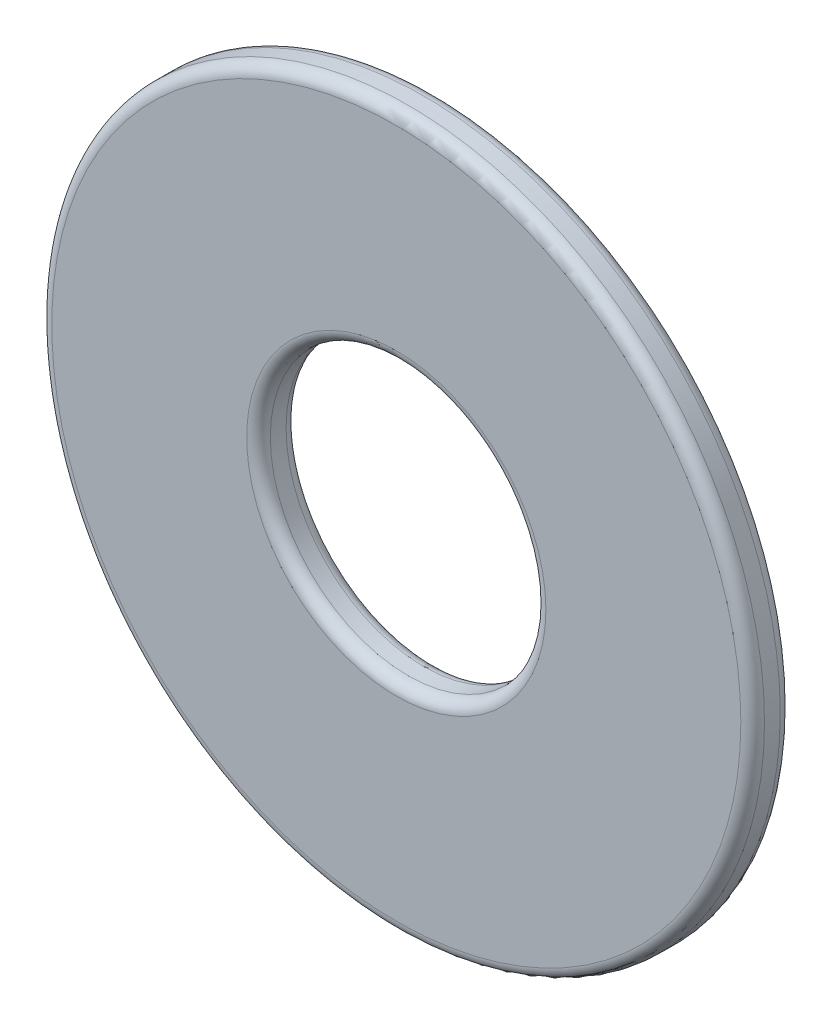
from build123d import *

# Parameters (mm, degrees)
ESBO_O1_R                = 9.05
ESBO_O1_R_2              = 3.5
RESSALTO_EXTRUS_O1_DEPTH = 1
FILETE1_R                = 0.3


with BuildPart() as part:
    # Esboço1 → Ressalto-extrusão1 (new body)
    with BuildSketch(Plane.XY):
        Circle(ESBO_O1_R)
        Circle(ESBO_O1_R_2, mode=Mode.SUBTRACT)
    extrude(amount=RESSALTO_EXTRUS_O1_DEPTH)

    # Filete1
    filete1_edges = [part.edges().sort_by_distance(p)[0] for p in [
        (-9.05, 0, 0),
        (-9.05, 0, 1),
        (-3.5, 0, 0),
        (-3.5, 0, 1),
    ]]
    fillet(filete1_edges, radius=FILETE1_R)


solid = part.part
